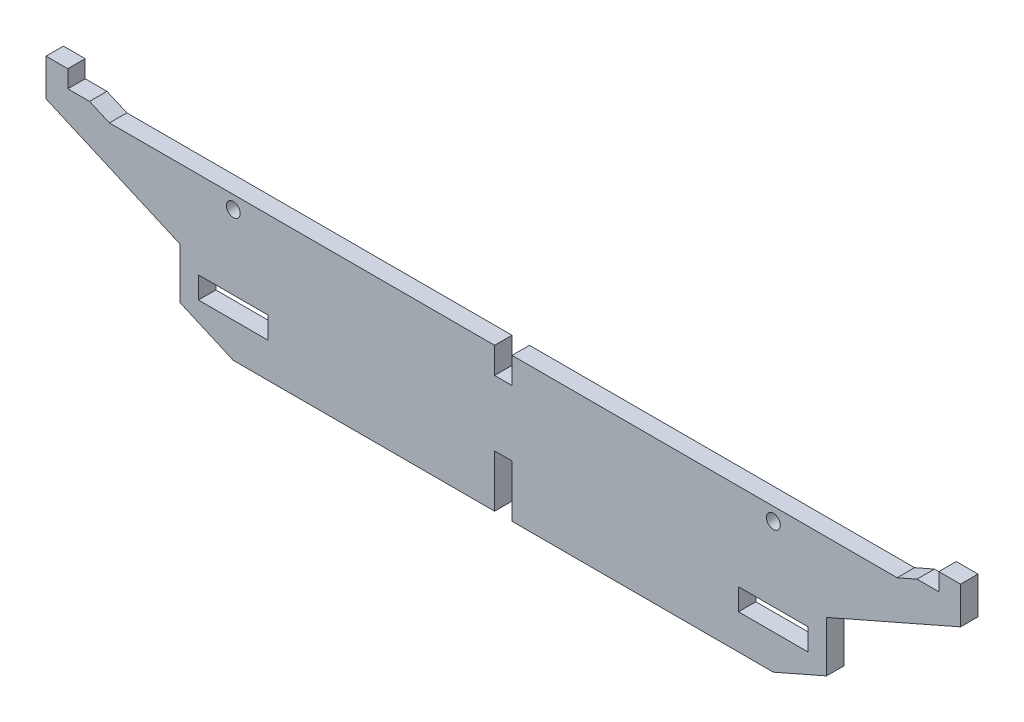
from build123d import *

# Parameters (mm, degrees)
BOSS_EXTRUDE1_DEPTH = 4
SKETCH2_R           = 1.6
SKETCH2_W           = 16
SKETCH2_H           = 5
CUT_EXTRUDE1_DEPTH  = 108.154094649


with BuildPart() as part:
    # Sketch1 → Boss-Extrude1 (new body)
    with BuildSketch(Plane.XY):
        Polygon((-95, 17), (-100, 17), (-100, 21), (-105, 21), (-105, 12.500446192), (-74.214666133, -1), (-74.214666133, -12.643441465), (-62, -18), (-2, -18), (-2, -6), (2, -6), (2, -18), (62, -18), (74.214666133, -12.643441465), (74.214666133, -1), (105, 12.500446192), (105, 21), (100, 21), (100, 17), (95, 17), (90.439360532, 15), (2, 15), (2, 9), (-2, 9), (-2, 15), (-90.439360532, 15), align=None)
    extrude(amount=BOSS_EXTRUDE1_DEPTH)

    # Sketch2 → Cut-Extrude1 (cut, through all)
    with BuildSketch(Plane.XY.offset(4)):
        with Locations((62, 12)):
            Circle(SKETCH2_R)
        with Locations((62, -7.5)):
            Rectangle(SKETCH2_W, SKETCH2_H)
    cut_extrude1 = extrude(amount=-CUT_EXTRUDE1_DEPTH, mode=Mode.SUBTRACT)

    # Mirror1: Cut-Extrude1 across plane
    add(cut_extrude1.mirror(Plane(origin=(0, 0, 0), x_dir=(0, 0, 1), z_dir=(1, 0, 0))), mode=Mode.SUBTRACT)


solid = part.part
